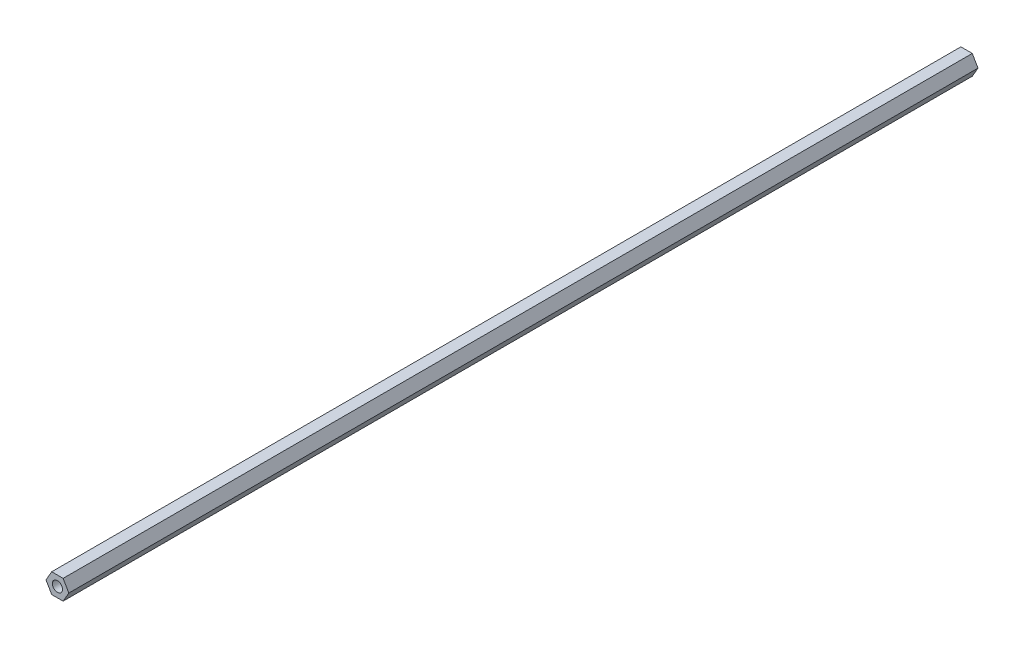
from build123d import *

# Parameters (mm, degrees)
SKETCH1_R           = 3.2639
BOSS_EXTRUDE1_DEPTH = 584.2


with BuildPart() as part:
    # Sketch1 → Boss-Extrude1 (new body)
    with BuildSketch(Plane.XY):
        Polygon((-3.666174209, 6.35), (-7.332348419, 0), (-3.666174209, -6.35), (3.666174209, -6.35), (7.332348419, 0), (3.666174209, 6.35), align=None)
        Circle(SKETCH1_R, mode=Mode.SUBTRACT)
    extrude(amount=BOSS_EXTRUDE1_DEPTH)


solid = part.part
